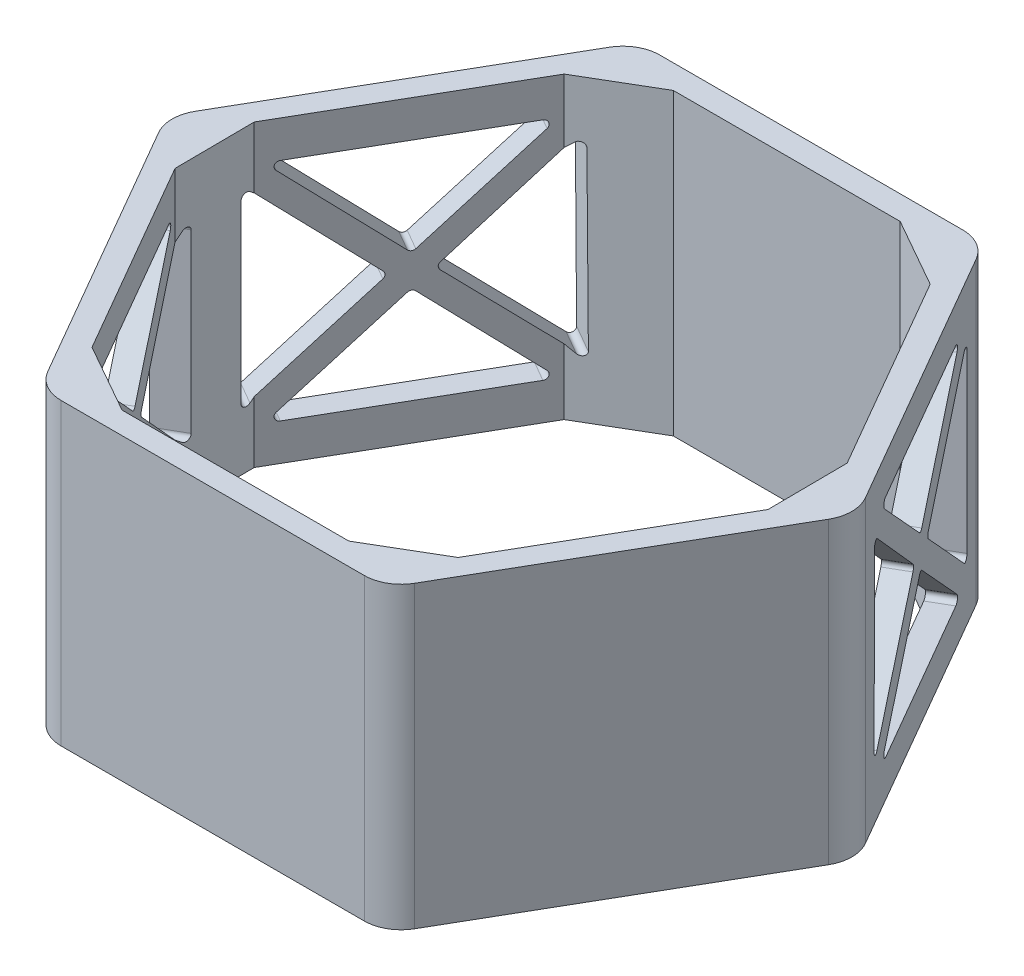
from build123d import *

# Parameters (mm, degrees)
BOSS_EXTRUDE1_DEPTH = 65
FILLET1_R           = 8
CUT_EXTRUDE1_DEPTH  = 65
CUT_EXTRUDE2_REACH  = 177.118
CUT_EXTRUDE3_DEPTH  = 50


with BuildPart() as part:
    # Sketch1 → Boss-Extrude1 (new body)
    with BuildSketch(Plane(origin=(0, 0, 0), x_dir=(1, 0, 0), z_dir=(0, 1, 0))):
        Polygon((-75.055534995, 0.197193855), (-37.527767497, -64.802806145), (37.527767497, -64.802806145), (75.055534995, 0.197193855), (37.527767497, 65.197193855), (-37.527767497, 65.197193855), align=None)
    extrude(amount=BOSS_EXTRUDE1_DEPTH)

    # Fillet1
    fillet1_edges = [part.edges().sort_by_distance(p)[0] for p in [
        (-37.527767497, 32.5, -65.197193855),
        (37.527767497, 32.5, -65.197193855),
        (75.055534995, 32.5, -0.197193855),
        (37.527767497, 32.5, 64.802806145),
        (-37.527767497, 32.5, 64.802806145),
        (-75.055534995, 32.5, -0.197193855),
    ]]
    fillet(fillet1_edges, radius=FILLET1_R)

    # Sketch2 → Cut-Extrude1 (cut)
    with BuildSketch(Plane(origin=(0, 0, 0), x_dir=(1, 0, 0), z_dir=(0, 1, 0))):
        Polygon((-39.707247658, 51.225029628), (-24.769507731, 60), (24.508553139, 60), (39.576770362, 51.451022934), (64.215800796, 8.774970372), (64.346278093, -8.548977066), (39.707247658, -51.225029628), (24.769507731, -60), (-24.508553139, -60), (-39.576770362, -51.451022934), (-64.215800796, -8.774970372), (-64.346278093, 8.548977066), align=None)
    extrude(amount=CUT_EXTRUDE1_DEPTH, mode=Mode.SUBTRACT)

    # Cut-Extrude2: up to this face of the body (flat: up to its plane)
    cut_extrude2_end = Plane(part.part.faces().sort_by_distance((56.291651246, 32.5, -32.697193855))[0])
    # Sketch4 → Cut-Extrude2 (cut, up to the picked face)
    with BuildSketch(Plane(origin=(-56.206263802, 0, 32.450701536), x_dir=(0.5000000000000002, 0, 0.8660254037844386), z_dir=(-0.8660254037844386, 0, 0.5000000000000002)), mode=Mode.PRIVATE) as cut_extrude2_sk1:
        with BuildLine():
            Line((-4.64838762, 31.756705854), (-25.916422712, 12.61547427))
            ThreePointArc((-25.916422712, 12.61547427), (-26.992226029, 12.445268353), (-27.585387444, 13.358768416))
            Line((-27.585387444, 13.358768416), (-27.585387444, 51.641231584))
            ThreePointArc((-27.585387444, 51.641231584), (-26.992226029, 52.554731647), (-25.916422712, 52.38452573))
            Line((-25.916422712, 52.38452573), (-4.64838762, 33.243294146))
            ThreePointArc((-4.64838762, 33.243294146), (-4.317352351, 32.5), (-4.64838762, 31.756705854))
        make_face()
    cut_extrude2_tool1 = split(extrude(cut_extrude2_sk1.sketch, amount=-CUT_EXTRUDE2_REACH, mode=Mode.PRIVATE), bisect_by=cut_extrude2_end, keep=Keep.BOTH, mode=Mode.PRIVATE)
    # Sketch4 → Cut-Extrude2 (cut, up to the picked face)
    with BuildSketch(Plane(origin=(-56.206263802, 0, 32.450701536), x_dir=(0.5000000000000002, 0, 0.8660254037844386), z_dir=(-0.8660254037844386, 0, 0.5000000000000002)), mode=Mode.PRIVATE) as cut_extrude2_sk2:
        with BuildLine():
            Line((-0.754352176, 36.46547427), (-21.63349838, 55.256705854))
            ThreePointArc((-21.63349838, 55.256705854), (-21.89815406, 56.358263767), (-20.964533648, 57))
            Line((-20.964533648, 57), (20.79375876, 57))
            ThreePointArc((20.79375876, 57), (21.727379172, 56.358263767), (21.462723491, 55.256705854))
            Line((21.462723491, 55.256705854), (0.583577288, 36.46547427))
            ThreePointArc((0.583577288, 36.46547427), (-0.085387444, 36.208768416), (-0.754352176, 36.46547427))
        make_face()
    cut_extrude2_tool2 = split(extrude(cut_extrude2_sk2.sketch, amount=-CUT_EXTRUDE2_REACH, mode=Mode.PRIVATE), bisect_by=cut_extrude2_end, keep=Keep.BOTH, mode=Mode.PRIVATE)
    # Sketch4 → Cut-Extrude2 (cut, up to the picked face)
    with BuildSketch(Plane(origin=(-56.206263802, 0, 32.450701536), x_dir=(0.5000000000000002, 0, 0.8660254037844386), z_dir=(-0.8660254037844386, 0, 0.5000000000000002)), mode=Mode.PRIVATE) as cut_extrude2_sk3:
        with BuildLine():
            Line((21.462723491, 9.743294146), (0.583577288, 28.53452573))
            ThreePointArc((0.583577288, 28.53452573), (-0.085387444, 28.791231584), (-0.754352176, 28.53452573))
            Line((-0.754352176, 28.53452573), (-21.63349838, 9.743294146))
            ThreePointArc((-21.63349838, 9.743294146), (-21.89815406, 8.641736233), (-20.964533648, 8))
            Line((-20.964533648, 8), (20.79375876, 8))
            ThreePointArc((20.79375876, 8), (21.727379172, 8.641736233), (21.462723491, 9.743294146))
        make_face()
    cut_extrude2_tool3 = split(extrude(cut_extrude2_sk3.sketch, amount=-CUT_EXTRUDE2_REACH, mode=Mode.PRIVATE), bisect_by=cut_extrude2_end, keep=Keep.BOTH, mode=Mode.PRIVATE)
    # Sketch4 → Cut-Extrude2 (cut, up to the picked face)
    with BuildSketch(Plane(origin=(-56.206263802, 0, 32.450701536), x_dir=(0.5000000000000002, 0, 0.8660254037844386), z_dir=(-0.8660254037844386, 0, 0.5000000000000002)), mode=Mode.PRIVATE) as cut_extrude2_sk4:
        with BuildLine():
            Line((25.640806472, 52.519982346), (4.473644042, 33.267260514))
            ThreePointArc((4.473644042, 33.267260514), (4.146519039, 32.52223718), (4.481455433, 31.780692745))
            Line((4.481455433, 31.780692745), (25.849775962, 12.751479913))
            ThreePointArc((25.849775962, 12.751479913), (26.926458787, 12.586929236), (27.514811958, 13.503533499))
            Line((27.514811958, 13.503533499), (27.313653858, 51.785468163))
            ThreePointArc((27.313653858, 51.785468163), (26.715700577, 52.695838803), (25.640806472, 52.519982346))
        make_face()
    cut_extrude2_tool4 = split(extrude(cut_extrude2_sk4.sketch, amount=-CUT_EXTRUDE2_REACH, mode=Mode.PRIVATE), bisect_by=cut_extrude2_end, keep=Keep.BOTH, mode=Mode.PRIVATE)
    add(cut_extrude2_tool1.solids().sort_by(Axis((-66.026454, 32.5, 15.441634), (0.8660254037844386, 0, -0.5000000000000002)))[0], mode=Mode.SUBTRACT)
    add(cut_extrude2_tool2.solids().sort_by(Axis((-56.248958, 49.92174, 32.376754), (0.8660254037844386, 0, -0.5000000000000002)))[0], mode=Mode.SUBTRACT)
    add(cut_extrude2_tool3.solids().sort_by(Axis((-56.248958, 15.07826, 32.376754), (0.8660254037844386, 0, -0.5000000000000002)))[0], mode=Mode.SUBTRACT)
    add(cut_extrude2_tool4.solids().sort_by(Axis((-46.471596, 32.602753, 49.31164), (0.8660254037844386, 0, -0.5000000000000002)))[0], mode=Mode.SUBTRACT)

    # Sketch6 → Cut-Extrude3 (cut)
    with BuildSketch(Plane(origin=(-56.206263802, 0, -32.845089247), x_dir=(0.5, 0, -0.8660254037844386), z_dir=(0.8660254037844387, 0, 0.5000000000000001))):
        with BuildLine():
            Line((-4.64838762, 31.756705854), (-25.916422712, 12.61547427))
            ThreePointArc((-25.916422712, 12.61547427), (-26.992226029, 12.445268353), (-27.585387444, 13.358768416))
            Line((-27.585387444, 13.358768416), (-27.585387444, 51.641231584))
            ThreePointArc((-27.585387444, 51.641231584), (-26.992226029, 52.554731647), (-25.916422712, 52.38452573))
            Line((-25.916422712, 52.38452573), (-4.64838762, 33.243294146))
            ThreePointArc((-4.64838762, 33.243294146), (-4.317352351, 32.5), (-4.64838762, 31.756705854))
        make_face()
        with BuildLine():
            Line((-0.754352176, 36.46547427), (-21.63349838, 55.256705854))
            ThreePointArc((-21.63349838, 55.256705854), (-21.89815406, 56.358263767), (-20.964533648, 57))
            Line((-20.964533648, 57), (20.79375876, 57))
            ThreePointArc((20.79375876, 57), (21.727379172, 56.358263767), (21.462723491, 55.256705854))
            Line((21.462723491, 55.256705854), (0.583577288, 36.46547427))
            ThreePointArc((0.583577288, 36.46547427), (-0.085387444, 36.208768416), (-0.754352176, 36.46547427))
        make_face()
        with BuildLine():
            Line((21.462723491, 9.743294146), (0.583577288, 28.53452573))
            ThreePointArc((0.583577288, 28.53452573), (-0.085387444, 28.791231584), (-0.754352176, 28.53452573))
            Line((-0.754352176, 28.53452573), (-21.63349838, 9.743294146))
            ThreePointArc((-21.63349838, 9.743294146), (-21.89815406, 8.641736233), (-20.964533648, 8))
            Line((-20.964533648, 8), (20.79375876, 8))
            ThreePointArc((20.79375876, 8), (21.727379172, 8.641736233), (21.462723491, 9.743294146))
        make_face()
        with BuildLine():
            Line((25.640806472, 52.519982346), (4.473644042, 33.267260514))
            ThreePointArc((4.473644042, 33.267260514), (4.146519039, 32.52223718), (4.481455433, 31.780692745))
            Line((4.481455433, 31.780692745), (25.849775962, 12.751479913))
            ThreePointArc((25.849775962, 12.751479913), (26.926458787, 12.586929236), (27.514811958, 13.503533499))
            Line((27.514811958, 13.503533499), (27.313653858, 51.785468163))
            ThreePointArc((27.313653858, 51.785468163), (26.715700577, 52.695838803), (25.640806472, 52.519982346))
        make_face()
    extrude(amount=CUT_EXTRUDE3_DEPTH, mode=Mode.SUBTRACT)


solid = part.part
